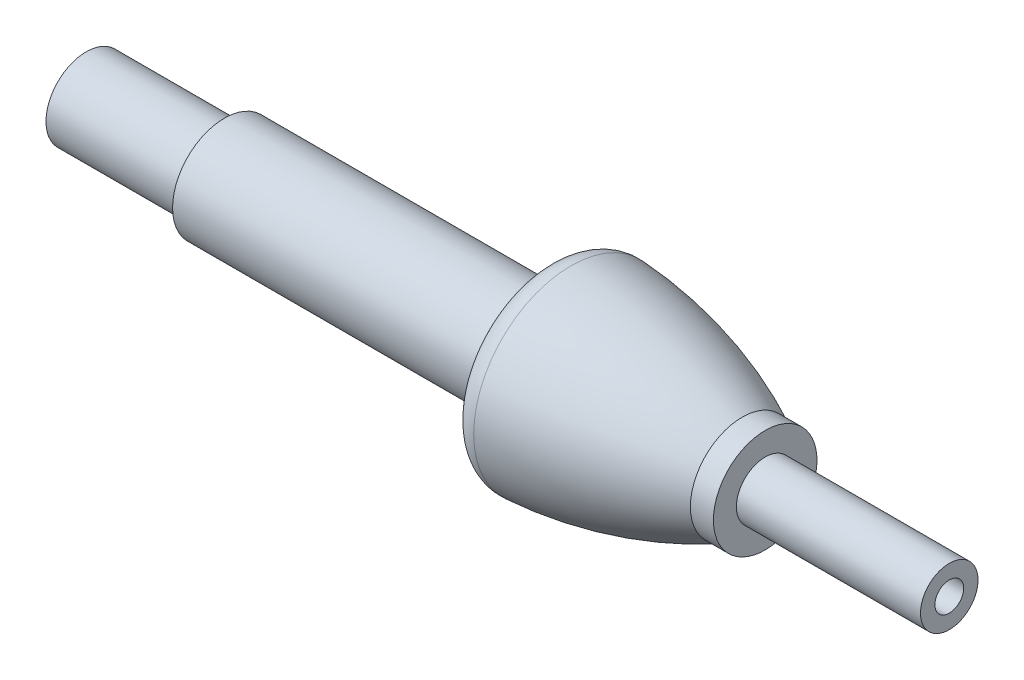
from build123d import *

# Parameters (mm, degrees)
REDONDEO1_R           = 2
CROQUIS2_R            = 1.25
CORTAR_EXTRUIR1_DEPTH = 76.944863877


with BuildPart() as part:
    # Croquis1 → Revolución1 (revolve)
    with BuildSketch(Plane.XY, mode=Mode.PRIVATE) as revoluci_n1_sk:
        with BuildLine():
            Line((-37.5, 0), (37.5, 0))
            Line((37.5, 0), (37.5, 2.5))
            Line((37.5, 2.5), (21.5, 2.5))
            Line((21.5, 2.5), (21.5, 4.5))
            Line((21.5, 4.5), (19.5, 4.5))
            ThreePointArc((19.5, 4.5), (11.232124598, 7.486529543), (2.5, 8.5))
            Line((2.5, 8.5), (2.5, 4.5))
            Line((2.5, 4.5), (-25.5, 4.5))
            Line((-25.5, 4.5), (-25.5, 3.5))
            Line((-25.5, 3.5), (-37.5, 3.5))
            Line((-37.5, 3.5), (-37.5, 0))
        make_face()
    revolve(revoluci_n1_sk.sketch.rotate(Axis((-37.5, 0, 0), (1, 0, 0)), 90), axis=Axis((-37.5, 0, 0), (1, 0, 0)))

    # Redondeo1
    redondeo1_edges = [part.edges().sort_by_distance(p)[0] for p in [
        (2.5, 0, -8.5),
    ]]
    fillet(redondeo1_edges, radius=REDONDEO1_R)

    # Croquis2 → Cortar-Extruir1 (cut, through all)
    with BuildSketch(Plane(origin=(37.5, 0, 0), x_dir=(0, 0, -1), z_dir=(1, 0, 0))):
        Circle(CROQUIS2_R)
    extrude(amount=-CORTAR_EXTRUIR1_DEPTH, mode=Mode.SUBTRACT)


solid = part.part
